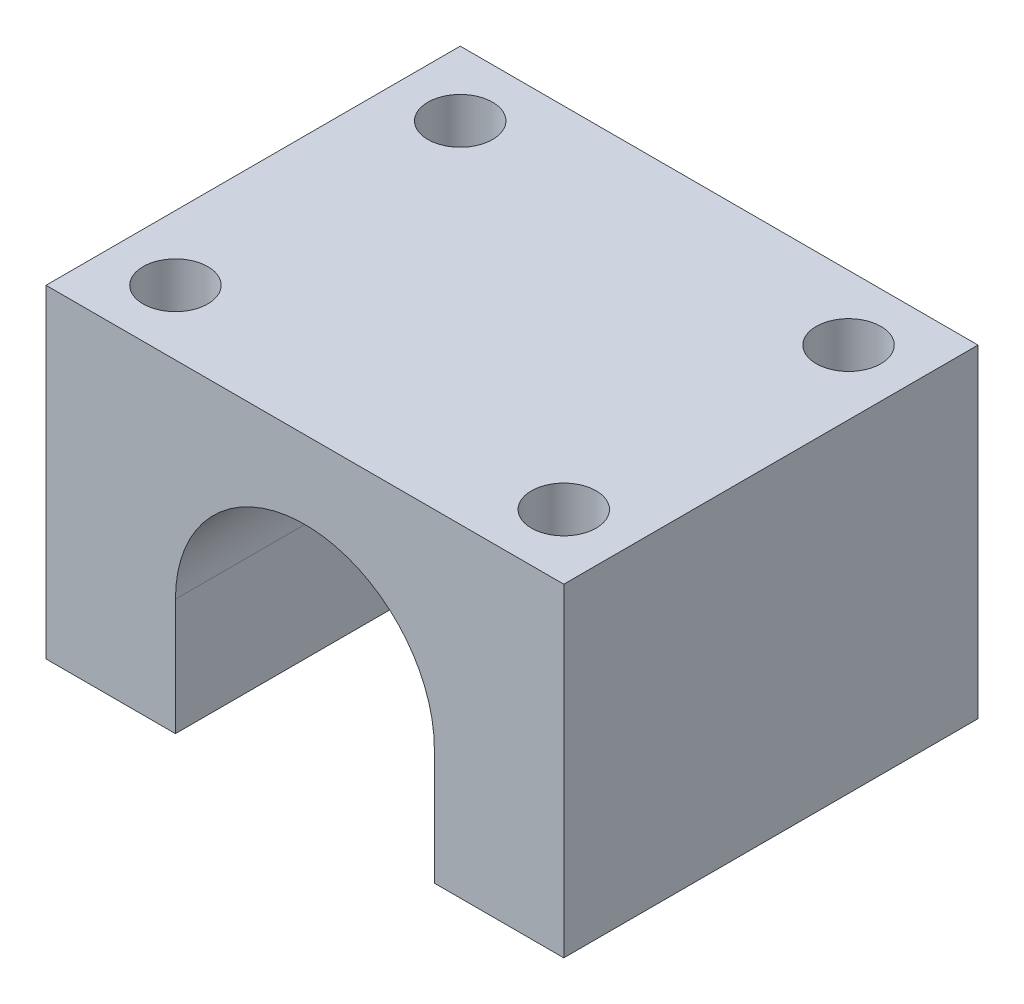
from build123d import *

# Parameters (mm, degrees)
BOSS_EXTRUDE1_DEPTH = 40.64
SKETCH2_R           = 3.175
CUT_EXTRUDE1_DEPTH  = 73.39


with BuildPart() as part:
    # Sketch1 → Boss-Extrude1 (new body)
    with BuildSketch(Plane.XY):
        with BuildLine():
            Line((0, 0), (50.8, 0))
            Line((50.8, 0), (50.8, -31.75))
            Line((50.8, -31.75), (38.1, -31.75))
            Line((38.1, -31.75), (38.1, -20.32))
            ThreePointArc((38.1, -20.32), (25.4, -7.62), (12.7, -20.32))
            Line((12.7, -20.32), (12.7, -31.75))
            Line((12.7, -31.75), (0, -31.75))
            Line((0, -31.75), (0, 0))
        make_face()
    extrude(amount=BOSS_EXTRUDE1_DEPTH)

    # Sketch2 → Cut-Extrude1 (cut, through all)
    with BuildSketch(Plane(origin=(0, 0, 0), x_dir=(1, 0, 0), z_dir=(0, 1, 0))):
        with Locations(Location((6.35, -6.35, 0), (0, 0, 270))):
            Circle(SKETCH2_R)
        with Locations(Location((44.45, -6.35, 0), (0, 0, 90))):
            Circle(SKETCH2_R)
        with Locations(Location((6.35, -34.29, 0), (0, 0, 90))):
            Circle(SKETCH2_R)
        with Locations(Location((44.45, -34.29, 0), (0, 0, 270))):
            Circle(SKETCH2_R)
    extrude(amount=-CUT_EXTRUDE1_DEPTH, mode=Mode.SUBTRACT)


solid = part.part
